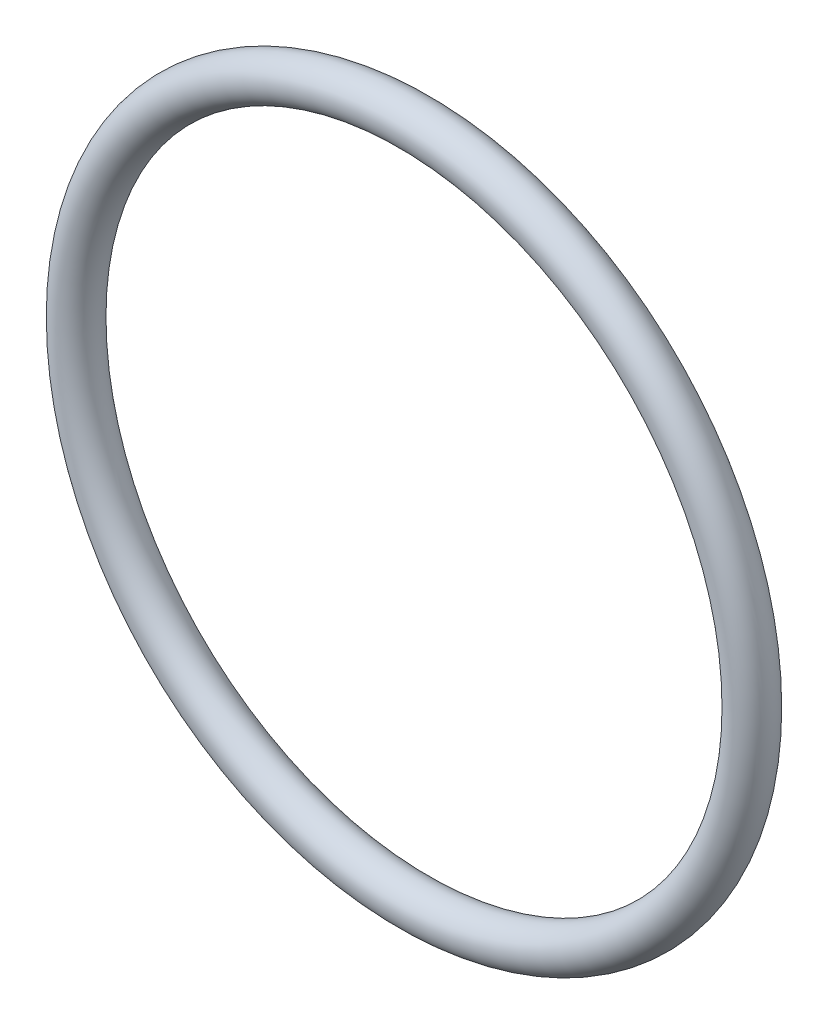
from build123d import *

# Parameters (mm, degrees)
BARRER1_PROFILE_R = 2.5


with BuildPart() as part:
    # Barrer1: sweep along a path in Croquis1
    with BuildLine(Plane.XY) as barrer1_path:
        CenterArc((0, 0), 40, 0, 360)
    # Barrer1 profile (on start of the path) → Barrer1 (sweep)
    with BuildSketch(Plane(origin=(40, 0, 0), x_dir=(0, 0, 1), z_dir=(0, 1, 0))):
        Circle(BARRER1_PROFILE_R)
    sweep(path=barrer1_path.line)


solid = part.part
